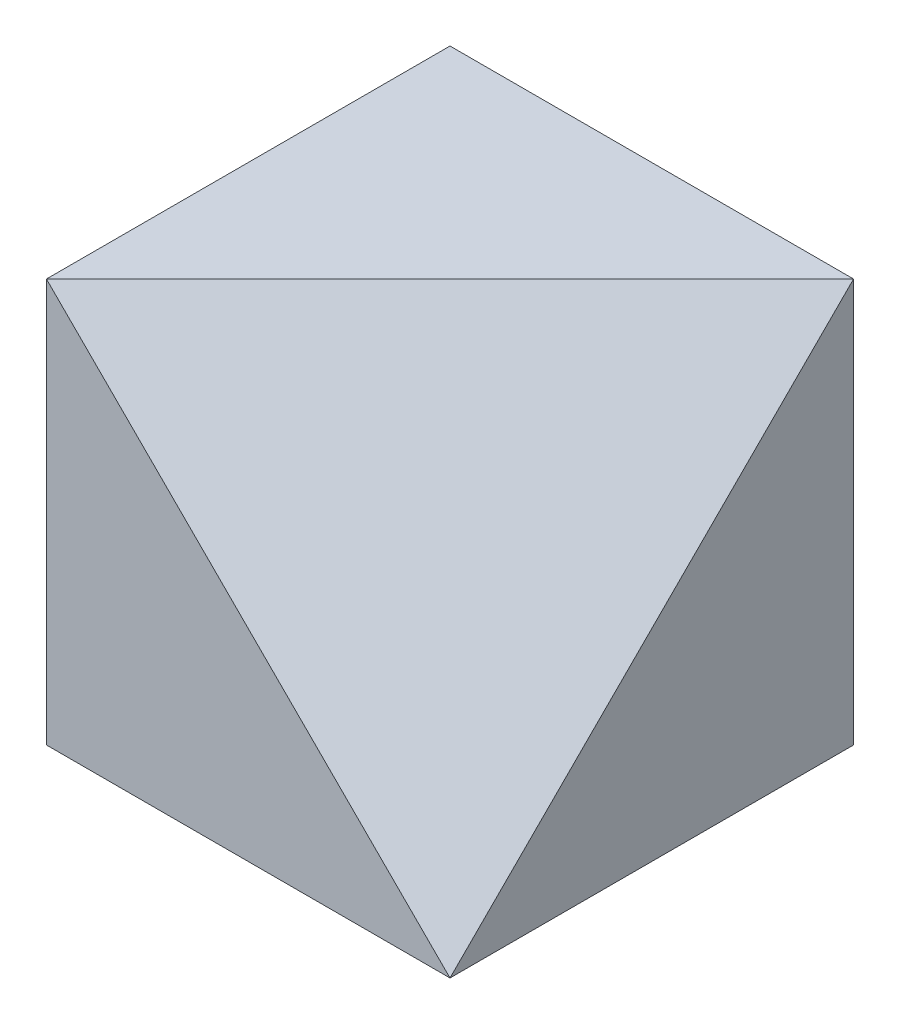
from build123d import *

# Parameters (mm, degrees)
SKETCH_1_W          = 100
SKETCH_1_H          = 100
EXTRUDE_1_DEPTH     = 100
CUT_EXTRUDE_1_DEPTH = 116.470053838


with BuildPart() as part:
    # 草圖1 → 填料-伸長1 (new body)
    with BuildSketch(Plane.XY):
        with Locations((50, 50)):
            Rectangle(SKETCH_1_W, SKETCH_1_H)
    extrude(amount=EXTRUDE_1_DEPTH)

    # 草圖3 → 除料-伸長1 (cut, through all)
    with BuildSketch(Plane(origin=(66.666666667, 66.666666667, 66.666666667), x_dir=(0.8164965809277261, -0.408248290463863, -0.408248290463863), z_dir=(0.5773502691896257, 0.5773502691896258, 0.5773502691896258))):
        Polygon((-81.649658093, 0), (40.824829046, 70.710678119), (40.824829046, -70.710678119), align=None)
    extrude(amount=CUT_EXTRUDE_1_DEPTH, mode=Mode.SUBTRACT)


solid = part.part
